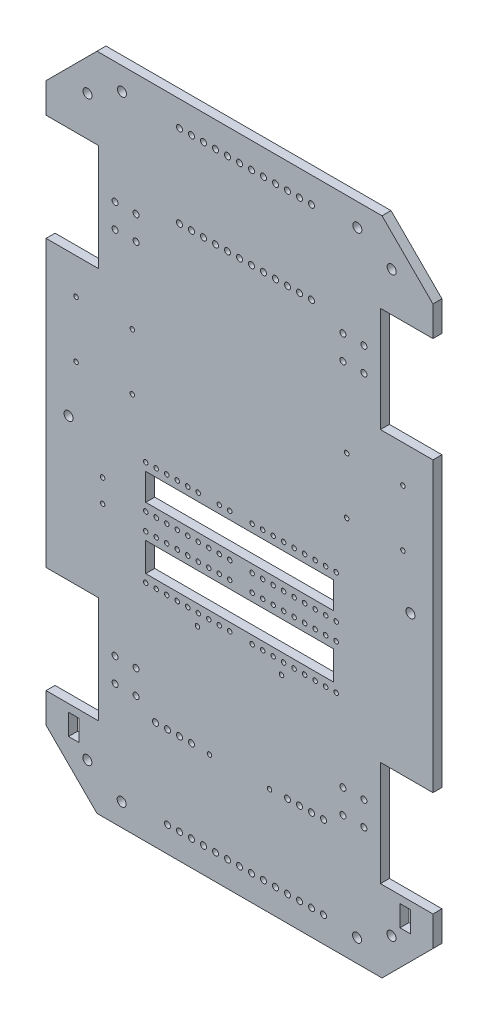
from build123d import *

# Parameters (mm, degrees)
SKETCH2_R           = 2
SKETCH2_R_2         = 1.5
SKETCH2_R_3         = 3
SKETCH2_W           = 125
SKETCH2_H           = 19.156930347
SKETCH2_W_2         = 163
SKETCH2_H_2         = 35
SKETCH2_W_3         = 80
SKETCH2_H_3         = 70
SKETCH2_H_4         = 17.829074366
SKETCH2_W_4         = 7
SKETCH2_H_5         = 14
BOSS_EXTRUDE1_DEPTH = 6
SKETCH3_W           = 163
SKETCH3_H           = 35
SKETCH3_W_2         = 80
SKETCH3_H_2         = 70
BOSS_EXTRUDE2_DEPTH = 3


with BuildPart() as part:
    # Sketch2 → Boss-Extrude1 (new body)
    with BuildSketch(Plane.XY):
        Polygon((-95, 227.558874503), (95, 227.558874503), (128.941125497, 193.617749006), (128.941125497, 173.617749006), (93.941125497, 173.617749006), (93.941125497, 103.617749006), (128.941125497, 103.617749006), (128.941125497, -88.5), (93.941125497, -88.5), (93.941125497, -158.5), (128.941125497, -158.5), (128.941125497, -178.5), (95, -212.441125497), (-95, -212.441125497), (-128.941125497, -178.5), (-128.941125497, -158.5), (-93.941125497, -158.5), (-93.941125497, -87.441125497), (-128.941125497, -87.441125497), (-128.941125497, 102.558874503), (-93.941125497, 102.558874503), (-93.941125497, 173.617749006), (-128.941125497, 173.617749006), (-128.941125497, 193.617749006), align=None)
        with Locations((-82.941125497, 146.617749006)):
            Circle(SKETCH2_R, mode=Mode.SUBTRACT)
        with Locations((-68.941125497, 146.617749006)):
            Circle(SKETCH2_R, mode=Mode.SUBTRACT)
        with Locations((-82.941125497, 130.617749006)):
            Circle(SKETCH2_R, mode=Mode.SUBTRACT)
        with Locations((-68.941125497, 130.617749006)):
            Circle(SKETCH2_R, mode=Mode.SUBTRACT)
        with Locations(Location((68.941125497, 130.617749006, 0), (0, 0, 180))):
            Circle(SKETCH2_R, mode=Mode.SUBTRACT)
        with Locations(Location((82.941125497, 130.617749006, 0), (0, 0, 180))):
            Circle(SKETCH2_R, mode=Mode.SUBTRACT)
        with Locations(Location((68.941125497, 146.617749006, 0), (0, 0, 180))):
            Circle(SKETCH2_R, mode=Mode.SUBTRACT)
        with Locations(Location((82.941125497, 146.617749006, 0), (0, 0, 180))):
            Circle(SKETCH2_R, mode=Mode.SUBTRACT)
        with Locations((82.941125497, -131.5)):
            Circle(SKETCH2_R, mode=Mode.SUBTRACT)
        with Locations((68.941125497, -131.5)):
            Circle(SKETCH2_R, mode=Mode.SUBTRACT)
        with Locations((82.941125497, -115.5)):
            Circle(SKETCH2_R, mode=Mode.SUBTRACT)
        with Locations((68.941125497, -115.5)):
            Circle(SKETCH2_R, mode=Mode.SUBTRACT)
        with Locations(Location((-68.941125497, -115.5, 0), (0, 0, 180))):
            Circle(SKETCH2_R, mode=Mode.SUBTRACT)
        with Locations(Location((-82.941125497, -115.5, 0), (0, 0, 180))):
            Circle(SKETCH2_R, mode=Mode.SUBTRACT)
        with Locations(Location((-68.941125497, -131.5, 0), (0, 0, 180))):
            Circle(SKETCH2_R, mode=Mode.SUBTRACT)
        with Locations(Location((-82.941125497, -131.5, 0), (0, 0, 180))):
            Circle(SKETCH2_R, mode=Mode.SUBTRACT)
        with Locations((108.941125497, 41.305983966)):
            Circle(SKETCH2_R_2, mode=Mode.SUBTRACT)
        with Locations((71.441125497, 41.305983966)):
            Circle(SKETCH2_R_2, mode=Mode.SUBTRACT)
        with Locations((108.941125497, 78.805983966)):
            Circle(SKETCH2_R_2, mode=Mode.SUBTRACT)
        with Locations((71.441125497, 78.805983966)):
            Circle(SKETCH2_R_2, mode=Mode.SUBTRACT)
        with Locations(Location((-71.441125497, 78.805983966, 0), (0, 0, 180))):
            Circle(SKETCH2_R_2, mode=Mode.SUBTRACT)
        with Locations(Location((-108.941125497, 78.805983966, 0), (0, 0, 180))):
            Circle(SKETCH2_R_2, mode=Mode.SUBTRACT)
        with Locations(Location((-71.441125497, 41.305983966, 0), (0, 0, 180))):
            Circle(SKETCH2_R_2, mode=Mode.SUBTRACT)
        with Locations(Location((-108.941125497, 41.305983966, 0), (0, 0, 180))):
            Circle(SKETCH2_R_2, mode=Mode.SUBTRACT)
        with Locations((0, 210.558874503)):
            Circle(SKETCH2_R, mode=Mode.SUBTRACT)
        with Locations((8, 210.558874503)):
            Circle(SKETCH2_R, mode=Mode.SUBTRACT)
        with Locations((16, 210.558874503)):
            Circle(SKETCH2_R, mode=Mode.SUBTRACT)
        with Locations((24, 210.558874503)):
            Circle(SKETCH2_R, mode=Mode.SUBTRACT)
        with Locations((32, 210.558874503)):
            Circle(SKETCH2_R, mode=Mode.SUBTRACT)
        with Locations((40, 210.558874503)):
            Circle(SKETCH2_R, mode=Mode.SUBTRACT)
        with Locations((48, 210.558874503)):
            Circle(SKETCH2_R, mode=Mode.SUBTRACT)
        with Locations(Location((-8, 210.558874503, 0), (0, 0, 180))):
            Circle(SKETCH2_R, mode=Mode.SUBTRACT)
        with Locations(Location((-16, 210.558874503, 0), (0, 0, 180))):
            Circle(SKETCH2_R, mode=Mode.SUBTRACT)
        with Locations(Location((-24, 210.558874503, 0), (0, 0, 180))):
            Circle(SKETCH2_R, mode=Mode.SUBTRACT)
        with Locations(Location((-32, 210.558874503, 0), (0, 0, 180))):
            Circle(SKETCH2_R, mode=Mode.SUBTRACT)
        with Locations(Location((-40, 210.558874503, 0), (0, 0, 180))):
            Circle(SKETCH2_R, mode=Mode.SUBTRACT)
        with Locations((-40, 155.558874503)):
            Circle(SKETCH2_R, mode=Mode.SUBTRACT)
        with Locations((-32, 155.558874503)):
            Circle(SKETCH2_R, mode=Mode.SUBTRACT)
        with Locations((-24, 155.558874503)):
            Circle(SKETCH2_R, mode=Mode.SUBTRACT)
        with Locations((-16, 155.558874503)):
            Circle(SKETCH2_R, mode=Mode.SUBTRACT)
        with Locations((-8, 155.558874503)):
            Circle(SKETCH2_R, mode=Mode.SUBTRACT)
        with Locations(Location((48, 155.558874503, 0), (0, 0, 180))):
            Circle(SKETCH2_R, mode=Mode.SUBTRACT)
        with Locations(Location((40, 155.558874503, 0), (0, 0, 180))):
            Circle(SKETCH2_R, mode=Mode.SUBTRACT)
        with Locations(Location((32, 155.558874503, 0), (0, 0, 180))):
            Circle(SKETCH2_R, mode=Mode.SUBTRACT)
        with Locations(Location((24, 155.558874503, 0), (0, 0, 180))):
            Circle(SKETCH2_R, mode=Mode.SUBTRACT)
        with Locations(Location((16, 155.558874503, 0), (0, 0, 180))):
            Circle(SKETCH2_R, mode=Mode.SUBTRACT)
        with Locations(Location((8, 155.558874503, 0), (0, 0, 180))):
            Circle(SKETCH2_R, mode=Mode.SUBTRACT)
        with Locations(Location((0, 155.558874503, 0), (0, 0, 180))):
            Circle(SKETCH2_R, mode=Mode.SUBTRACT)
        with Locations((32, -140.441125497)):
            Circle(SKETCH2_R, mode=Mode.SUBTRACT)
        with Locations((40, -140.441125497)):
            Circle(SKETCH2_R, mode=Mode.SUBTRACT)
        with Locations((48, -140.441125497)):
            Circle(SKETCH2_R, mode=Mode.SUBTRACT)
        with Locations((56, -140.441125497)):
            Circle(SKETCH2_R, mode=Mode.SUBTRACT)
        with Locations(Location((-32, -140.441125497, 0), (0, 0, 180))):
            Circle(SKETCH2_R, mode=Mode.SUBTRACT)
        with Locations(Location((-40, -140.441125497, 0), (0, 0, 180))):
            Circle(SKETCH2_R, mode=Mode.SUBTRACT)
        with Locations(Location((-48, -140.441125497, 0), (0, 0, 180))):
            Circle(SKETCH2_R, mode=Mode.SUBTRACT)
        with Locations(Location((-56, -140.441125497, 0), (0, 0, 180))):
            Circle(SKETCH2_R, mode=Mode.SUBTRACT)
        with Locations((-48, -195.441125497)):
            Circle(SKETCH2_R, mode=Mode.SUBTRACT)
        with Locations((-40, -195.441125497)):
            Circle(SKETCH2_R, mode=Mode.SUBTRACT)
        with Locations((-32, -195.441125497)):
            Circle(SKETCH2_R, mode=Mode.SUBTRACT)
        with Locations((-24, -195.441125497)):
            Circle(SKETCH2_R, mode=Mode.SUBTRACT)
        with Locations((-16, -195.441125497)):
            Circle(SKETCH2_R, mode=Mode.SUBTRACT)
        with Locations((-8, -195.441125497)):
            Circle(SKETCH2_R, mode=Mode.SUBTRACT)
        with Locations(Location((56, -195.441125497, 0), (0, 0, 180))):
            Circle(SKETCH2_R, mode=Mode.SUBTRACT)
        with Locations(Location((48, -195.441125497, 0), (0, 0, 180))):
            Circle(SKETCH2_R, mode=Mode.SUBTRACT)
        with Locations(Location((40, -195.441125497, 0), (0, 0, 180))):
            Circle(SKETCH2_R, mode=Mode.SUBTRACT)
        with Locations(Location((32, -195.441125497, 0), (0, 0, 180))):
            Circle(SKETCH2_R, mode=Mode.SUBTRACT)
        with Locations(Location((24, -195.441125497, 0), (0, 0, 180))):
            Circle(SKETCH2_R, mode=Mode.SUBTRACT)
        with Locations(Location((16, -195.441125497, 0), (0, 0, 180))):
            Circle(SKETCH2_R, mode=Mode.SUBTRACT)
        with Locations(Location((8, -195.441125497, 0), (0, 0, 180))):
            Circle(SKETCH2_R, mode=Mode.SUBTRACT)
        with Locations(Location((0, -195.441125497, 0), (0, 0, 180))):
            Circle(SKETCH2_R, mode=Mode.SUBTRACT)
        with Locations((-20, -140.94724206)):
            Circle(SKETCH2_R_2, mode=Mode.SUBTRACT)
        with Locations((64.414040304, -63.063051829)):
            Circle(SKETCH2_R_2, mode=Mode.SUBTRACT)
        with Locations((57.414040304, -63.063051829)):
            Circle(SKETCH2_R_2, mode=Mode.SUBTRACT)
        with Locations((50.414040304, -63.063051829)):
            Circle(SKETCH2_R_2, mode=Mode.SUBTRACT)
        with Locations((43.414040304, -63.063051829)):
            Circle(SKETCH2_R_2, mode=Mode.SUBTRACT)
        with Locations((36.414040304, -63.063051829)):
            Circle(SKETCH2_R_2, mode=Mode.SUBTRACT)
        with Locations((29.414040304, -63.063051829)):
            Circle(SKETCH2_R_2, mode=Mode.SUBTRACT)
        with Locations((28, -70.94724206)):
            Circle(SKETCH2_R_2, mode=Mode.SUBTRACT)
        with Locations((22.414040304, -63.063051829)):
            Circle(SKETCH2_R_2, mode=Mode.SUBTRACT)
        with Locations((15.414040304, -63.063051829)):
            Circle(SKETCH2_R_2, mode=Mode.SUBTRACT)
        with Locations((8.414040304, -63.063051829)):
            Circle(SKETCH2_R_2, mode=Mode.SUBTRACT)
        with Locations((-28, -70.94724206)):
            Circle(SKETCH2_R_2, mode=Mode.SUBTRACT)
        with Locations((-6.5, -63.063051829)):
            Circle(SKETCH2_R_2, mode=Mode.SUBTRACT)
        with Locations((-13.5, -63.063051829)):
            Circle(SKETCH2_R_2, mode=Mode.SUBTRACT)
        with Locations((-20.5, -63.063051829)):
            Circle(SKETCH2_R_2, mode=Mode.SUBTRACT)
        with Locations((-27.5, -63.063051829)):
            Circle(SKETCH2_R_2, mode=Mode.SUBTRACT)
        with Locations((-34.5, -63.063051829)):
            Circle(SKETCH2_R_2, mode=Mode.SUBTRACT)
        with Locations((-41.5, -63.063051829)):
            Circle(SKETCH2_R_2, mode=Mode.SUBTRACT)
        with Locations((-48.5, -63.063051829)):
            Circle(SKETCH2_R_2, mode=Mode.SUBTRACT)
        with Locations((-55.5, -63.063051829)):
            Circle(SKETCH2_R_2, mode=Mode.SUBTRACT)
        with Locations((-62.5, -63.063051829)):
            Circle(SKETCH2_R_2, mode=Mode.SUBTRACT)
        with Locations((64.414040304, -33.323783276)):
            Circle(SKETCH2_R_2, mode=Mode.SUBTRACT)
        with Locations((57.414040304, -33.323783276)):
            Circle(SKETCH2_R_2, mode=Mode.SUBTRACT)
        with Locations((50.414040304, -33.323783276)):
            Circle(SKETCH2_R_2, mode=Mode.SUBTRACT)
        with Locations((43.414040304, -33.323783276)):
            Circle(SKETCH2_R_2, mode=Mode.SUBTRACT)
        with Locations((36.414040304, -33.323783276)):
            Circle(SKETCH2_R_2, mode=Mode.SUBTRACT)
        with Locations((29.414040304, -33.323783276)):
            Circle(SKETCH2_R_2, mode=Mode.SUBTRACT)
        with Locations((22.414040304, -33.323783276)):
            Circle(SKETCH2_R_2, mode=Mode.SUBTRACT)
        with Locations((8.414040304, -33.323783276)):
            Circle(SKETCH2_R_2, mode=Mode.SUBTRACT)
        with Locations((15.414040304, -33.323783276)):
            Circle(SKETCH2_R_2, mode=Mode.SUBTRACT)
        with Locations((-6.5, -33.323783276)):
            Circle(SKETCH2_R_2, mode=Mode.SUBTRACT)
        with Locations((-13.5, -33.323783276)):
            Circle(SKETCH2_R_2, mode=Mode.SUBTRACT)
        with Locations((-20.5, -33.323783276)):
            Circle(SKETCH2_R_2, mode=Mode.SUBTRACT)
        with Locations((-27.5, -33.323783276)):
            Circle(SKETCH2_R_2, mode=Mode.SUBTRACT)
        with Locations((-34.5, -33.323783276)):
            Circle(SKETCH2_R_2, mode=Mode.SUBTRACT)
        with Locations((-41.5, -33.323783276)):
            Circle(SKETCH2_R_2, mode=Mode.SUBTRACT)
        with Locations((-48.5, -33.323783276)):
            Circle(SKETCH2_R_2, mode=Mode.SUBTRACT)
        with Locations((-55.5, -33.323783276)):
            Circle(SKETCH2_R_2, mode=Mode.SUBTRACT)
        with Locations((-62.5, -33.323783276)):
            Circle(SKETCH2_R_2, mode=Mode.SUBTRACT)
        with Locations((-62.5, -21.892126195)):
            Circle(SKETCH2_R_2, mode=Mode.SUBTRACT)
        with Locations((-55.5, -21.892126195)):
            Circle(SKETCH2_R_2, mode=Mode.SUBTRACT)
        with Locations((-48.5, -21.892126195)):
            Circle(SKETCH2_R_2, mode=Mode.SUBTRACT)
        with Locations((-41.5, -21.892126195)):
            Circle(SKETCH2_R_2, mode=Mode.SUBTRACT)
        with Locations((-34.5, -21.892126195)):
            Circle(SKETCH2_R_2, mode=Mode.SUBTRACT)
        with Locations((-27.5, -21.892126195)):
            Circle(SKETCH2_R_2, mode=Mode.SUBTRACT)
        with Locations((-20.5, -21.892126195)):
            Circle(SKETCH2_R_2, mode=Mode.SUBTRACT)
        with Locations((-13.5, -21.892126195)):
            Circle(SKETCH2_R_2, mode=Mode.SUBTRACT)
        with Locations((8.414040304, -21.892126195)):
            Circle(SKETCH2_R_2, mode=Mode.SUBTRACT)
        with Locations((-6.5, -21.892126195)):
            Circle(SKETCH2_R_2, mode=Mode.SUBTRACT)
        with Locations((15.414040304, -21.892126195)):
            Circle(SKETCH2_R_2, mode=Mode.SUBTRACT)
        with Locations((22.414040304, -21.892126195)):
            Circle(SKETCH2_R_2, mode=Mode.SUBTRACT)
        with Locations((29.414040304, -21.892126195)):
            Circle(SKETCH2_R_2, mode=Mode.SUBTRACT)
        with Locations((36.414040304, -21.892126195)):
            Circle(SKETCH2_R_2, mode=Mode.SUBTRACT)
        with Locations((43.414040304, -21.892126195)):
            Circle(SKETCH2_R_2, mode=Mode.SUBTRACT)
        with Locations((50.414040304, -21.892126195)):
            Circle(SKETCH2_R_2, mode=Mode.SUBTRACT)
        with Locations((64.414040304, -21.892126195)):
            Circle(SKETCH2_R_2, mode=Mode.SUBTRACT)
        with Locations((57.414040304, -21.892126195)):
            Circle(SKETCH2_R_2, mode=Mode.SUBTRACT)
        with Locations((64.414040304, 6.519286377)):
            Circle(SKETCH2_R_2, mode=Mode.SUBTRACT)
        with Locations((57.414040304, 6.519286377)):
            Circle(SKETCH2_R_2, mode=Mode.SUBTRACT)
        with Locations((50.414040304, 6.519286377)):
            Circle(SKETCH2_R_2, mode=Mode.SUBTRACT)
        with Locations((43.414040304, 6.519286377)):
            Circle(SKETCH2_R_2, mode=Mode.SUBTRACT)
        with Locations((36.414040304, 6.519286377)):
            Circle(SKETCH2_R_2, mode=Mode.SUBTRACT)
        with Locations((29.414040304, 6.519286377)):
            Circle(SKETCH2_R_2, mode=Mode.SUBTRACT)
        with Locations((22.414040304, 6.519286377)):
            Circle(SKETCH2_R_2, mode=Mode.SUBTRACT)
        with Locations((15.414040304, 6.519286377)):
            Circle(SKETCH2_R_2, mode=Mode.SUBTRACT)
        with Locations((8.414040304, 6.519286377)):
            Circle(SKETCH2_R_2, mode=Mode.SUBTRACT)
        with Locations((-13.5, 6.519286377)):
            Circle(SKETCH2_R_2, mode=Mode.SUBTRACT)
        with Locations((-6.5, 6.519286377)):
            Circle(SKETCH2_R_2, mode=Mode.SUBTRACT)
        with Locations((-27.5, 6.519286377)):
            Circle(SKETCH2_R_2, mode=Mode.SUBTRACT)
        with Locations((-41.5, 6.519286377)):
            Circle(SKETCH2_R_2, mode=Mode.SUBTRACT)
        with Locations((-34.5, 6.519286377)):
            Circle(SKETCH2_R_2, mode=Mode.SUBTRACT)
        with Locations((-48.5, 6.519286377)):
            Circle(SKETCH2_R_2, mode=Mode.SUBTRACT)
        with Locations((-55.5, 6.519286377)):
            Circle(SKETCH2_R_2, mode=Mode.SUBTRACT)
        with Locations((-62.5, 6.519286377)):
            Circle(SKETCH2_R_2, mode=Mode.SUBTRACT)
        with Locations((-91.247211746, -31.832409383)):
            Circle(SKETCH2_R_2, mode=Mode.SUBTRACT)
        with Locations((-91.247211746, -16.650559383)):
            Circle(SKETCH2_R_2, mode=Mode.SUBTRACT)
        with Locations((20, -140.94724206)):
            Circle(SKETCH2_R_2, mode=Mode.SUBTRACT)
        with Locations((-113.941125497, 7.558874503)):
            Circle(SKETCH2_R_3, mode=Mode.SUBTRACT)
        with Locations(Location((113.941125497, 7.558874503, 0), (0, 0, 180))):
            Circle(SKETCH2_R_3, mode=Mode.SUBTRACT)
        with Locations((-101.293979907, 200.05169116)):
            Circle(SKETCH2_R_3, mode=Mode.SUBTRACT)
        with Locations((101.433942154, 199.911728913)):
            Circle(SKETCH2_R_3, mode=Mode.SUBTRACT)
        with Locations((101.293979907, -184.933942154)):
            Circle(SKETCH2_R_3, mode=Mode.SUBTRACT)
        with Locations((-101.433942154, -184.793979907)):
            Circle(SKETCH2_R_3, mode=Mode.SUBTRACT)
        with Locations((-78.553968254, -197.441125497)):
            Circle(SKETCH2_R_3, mode=Mode.SUBTRACT)
        with Locations((78.346031746, -197.441125497)):
            Circle(SKETCH2_R_3, mode=Mode.SUBTRACT)
        with Locations((78.553968254, 212.558874503)):
            Circle(SKETCH2_R_3, mode=Mode.SUBTRACT)
        with Locations((-78.346031746, 212.558874503)):
            Circle(SKETCH2_R_3, mode=Mode.SUBTRACT)
        with Locations((0, -48.193417553)):
            Rectangle(SKETCH2_W, SKETCH2_H, mode=Mode.SUBTRACT)
        with Locations((0, 183.058874503)):
            Rectangle(SKETCH2_W_2, SKETCH2_H_2, mode=Mode.SUBTRACT)
        with Locations((0, 55.497109463)):
            Rectangle(SKETCH2_W_3, SKETCH2_H_3, mode=Mode.SUBTRACT)
        with Locations((0, -167.941125497)):
            Rectangle(SKETCH2_W_2, SKETCH2_H_2, mode=Mode.SUBTRACT)
        with Locations((0, -7.686419909)):
            Rectangle(SKETCH2_W, SKETCH2_H_4, mode=Mode.SUBTRACT)
        with Locations((-110.441125497, -170.5)):
            Rectangle(SKETCH2_W_4, SKETCH2_H_5, mode=Mode.SUBTRACT)
        with Locations((110.441125497, -170.5)):
            Rectangle(SKETCH2_W_4, SKETCH2_H_5, mode=Mode.SUBTRACT)
    extrude(amount=BOSS_EXTRUDE1_DEPTH)

    # Sketch3 → Boss-Extrude2 (add)
    with BuildSketch(Plane.XY.offset(6)):
        with Locations((0, 183.058874503)):
            Rectangle(SKETCH3_W, SKETCH3_H)
        with Locations((0, 55.497109463)):
            Rectangle(SKETCH3_W_2, SKETCH3_H_2)
        with Locations((0, -167.941125497)):
            Rectangle(SKETCH3_W, SKETCH3_H)
    extrude(amount=-BOSS_EXTRUDE2_DEPTH)


solid = part.part
